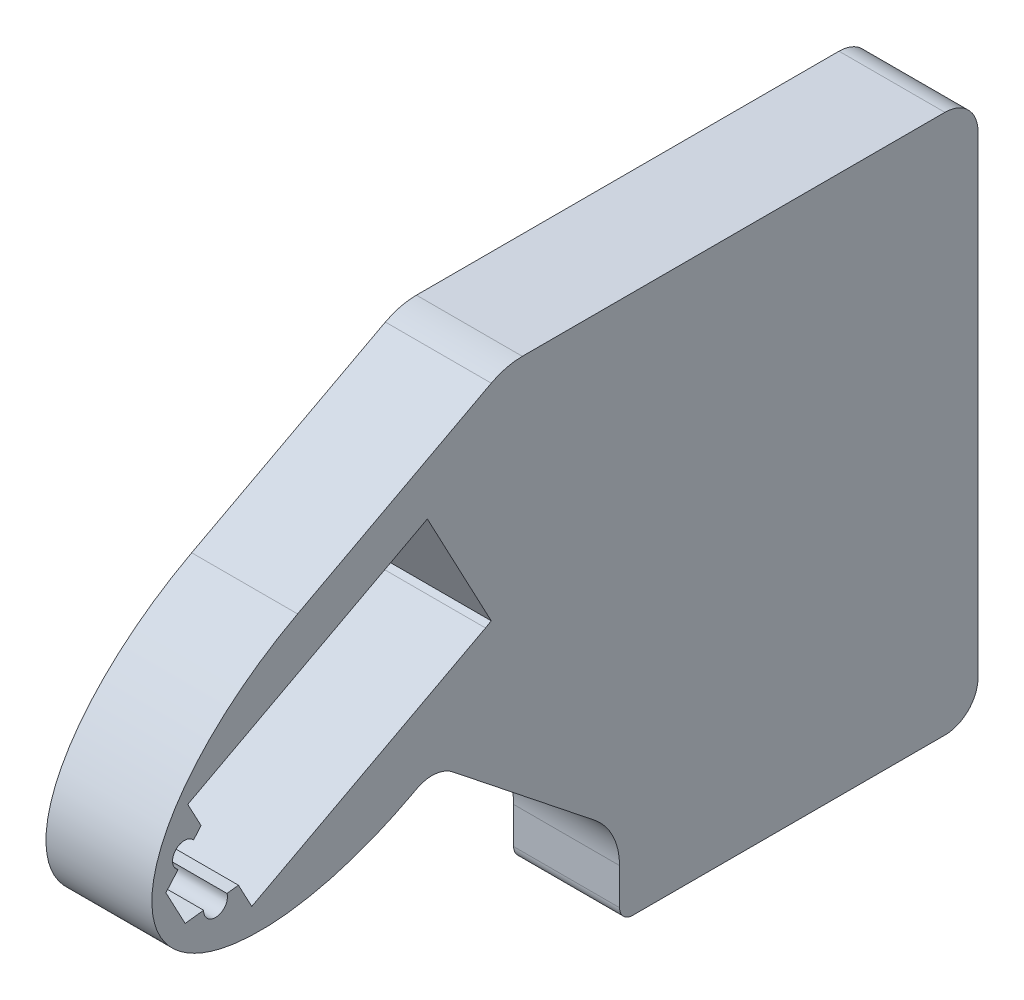
from build123d import *

# Parameters (mm, degrees)
EXTRUDE_1_DEPTH          = 16
SKETCH_1_12_R            = 1.8
CUT_EXTRUDE_3_DEPTH      = 11
CUT_EXTRUDE_5_DEPTH      = 136.835525964
CUT_EXTRUDE_5_DEPTH_BACK = 136.835525964
SKETCH_3_R               = 1.6
SKETCH_5_W               = 11.148525628
SKETCH_5_H               = 46.436292238
EXTRUDE_5_DEPTH          = 8.268698
CUT_EXTRUDE_7_DEPTH      = 20


with BuildPart() as part:
    # 草图1 → 凸台-拉伸1 (new body)
    with BuildSketch(Plane(origin=(0, 0, 0), x_dir=(0, 0, -1), z_dir=(1, 0, 0))):
        with BuildLine():
            Line((59.126763237, -65.71435988), (59.126763237, -71.224186709))
            ThreePointArc((59.126763237, -71.224186709), (59.712549674, -72.638400271), (61.126763237, -73.224186709))
            Line((61.126763237, -73.224186709), (108.285076486, -73.224186709))
            ThreePointArc((108.285076486, -73.224186709), (111.820610392, -71.759720614), (113.285076486, -68.224186709))
            Line((113.285076486, -68.224186709), (113.285076486, 3.268698301))
            ThreePointArc((113.285076486, 3.268698301), (111.820610392, 6.804232207), (108.285076486, 8.268698301))
            Line((108.285076486, 8.268698301), (44.437384067, 8.268698301))
            ThreePointArc((44.437384067, 8.268698301), (42.018165111, 7.971655564), (39.742668439, 7.098174229))
            Line((39.742668439, 7.098174229), (10.48020136, -8.46095551))
            add(Edge.make_bspline(
                [(10.48020136, -8.46095551), (-18.899584584, -24.082464797), (-10.308254985, -40.240405746), (-1.716925386, -56.398346695), (27.662860558, -40.776837409)],
                knots=[1.570796327, 1.570796327, 1.570796327, 3.141592654, 3.141592654, 4.71238898, 4.71238898, 4.71238898], degree=2, weights=[1, 0.707106781, 1, 0.707106781, 1]))
            Line((27.662860558, -40.776837409), (28.45929676, -40.353364768))
            ThreePointArc((28.45929676, -40.353364768), (31.26308739, -39.788979408), (33.917537352, -40.853717936))
            Line((33.917537352, -40.853717936), (55.348528793, -57.885590286))
            ThreePointArc((55.348528793, -57.885590286), (58.132807195, -61.367962267), (59.126763237, -65.71435988))
        make_face()
    extrude(amount=EXTRUDE_1_DEPTH)

    # 草图1<12> → 切除-拉伸3 (cut)
    with BuildSketch(Plane(origin=(0, 0, 0), x_dir=(0, 0, -1), z_dir=(1, 0, 0))):
        with Locations((40.800977433, -17.471989752)):
            Circle(SKETCH_1_12_R)
        with Locations(Location((36.107251708, -8.64005263, 0), (0, 0, 180))):
            Circle(SKETCH_1_12_R)
    extrude(amount=CUT_EXTRUDE_3_DEPTH, mode=Mode.SUBTRACT)

    # 草图3 → 切除-拉伸5 (cut, two sides: drawn at the far end of the back side and taken through both)
    with BuildSketch(Plane(origin=(0, 0, 0), x_dir=(1, 0, 0), z_dir=(0, 1, 0)).offset(-CUT_EXTRUDE_5_DEPTH_BACK)):
        with Locations(Location((9.961161351, 103.479269729, 0), (0, 0, 270))):
            Circle(SKETCH_3_R)
        with Locations(Location((9.999259871, 93.479342304, 0), (0, 0, 270))):
            Circle(SKETCH_3_R)
        with Locations(Location((9.999985896, 83.47934233, 0), (0, 0, 270))):
            Circle(SKETCH_3_R)
        with Locations(Location((9.999999731, 73.47934233, 0), (0, 0, 270))):
            Circle(SKETCH_3_R)
        with Locations(Location((9.999999994, 65.47934233, 0), (0, 0, 270))):
            Circle(SKETCH_3_R)
    extrude(amount=CUT_EXTRUDE_5_DEPTH + CUT_EXTRUDE_5_DEPTH_BACK, mode=Mode.SUBTRACT)

    # 草图5 → 凸台-拉伸5 (add, through all)
    with BuildSketch(Plane(origin=(0, 0, 0), x_dir=(1, 0, 0), z_dir=(0, 1, 0))):
        with Locations((9.530048776, 84.64819368)):
            Rectangle(SKETCH_5_W, SKETCH_5_H)
    extrude(amount=EXTRUDE_5_DEPTH)

    # 草图1<19> → 切除-拉伸7 (cut)
    with BuildSketch(Plane(origin=(0, 0, 0), x_dir=(0, 0, -1), z_dir=(1, 0, 0))):
        with BuildLine():
            Line((-6.115071551, -25.08624568), (-4.101865535, -28.872535514))
            Line((-4.101865535, -28.872535514), (-5.245216271, -30.189046212))
            ThreePointArc((-5.245216271, -30.189046212), (-7.975277848, -30.175074758), (-7.578978461, -32.87625565))
            Line((-7.578978461, -32.87625565), (-9.418626951, -34.994518089))
            Line((-9.418626951, -34.994518089), (-6.505612199, -40.473102026))
            Line((-6.505612199, -40.473102026), (-3.720774668, -40.132481631))
            ThreePointArc((-3.720774668, -40.132481631), (-1.703002024, -41.971509898), (-0.187953824, -39.700373538))
            Line((-0.187953824, -39.700373538), (1.542836627, -39.488676259))
            Line((1.542836627, -39.488676259), (3.556042643, -43.274966093))
            Line((3.556042643, -43.274966093), (38.873946357, -24.496103581))
            Line((38.873946357, -24.496103581), (39.742668439, -23.999877724))
            Line((39.742668439, -23.999877724), (30.085779757, -5.837911606))
            Line((30.085779757, -5.837911606), (29.202832164, -6.307383168))
            Line((29.202832164, -6.307383168), (-6.115071551, -25.08624568))
        make_face()
    extrude(amount=CUT_EXTRUDE_7_DEPTH, mode=Mode.SUBTRACT)


solid = part.part
